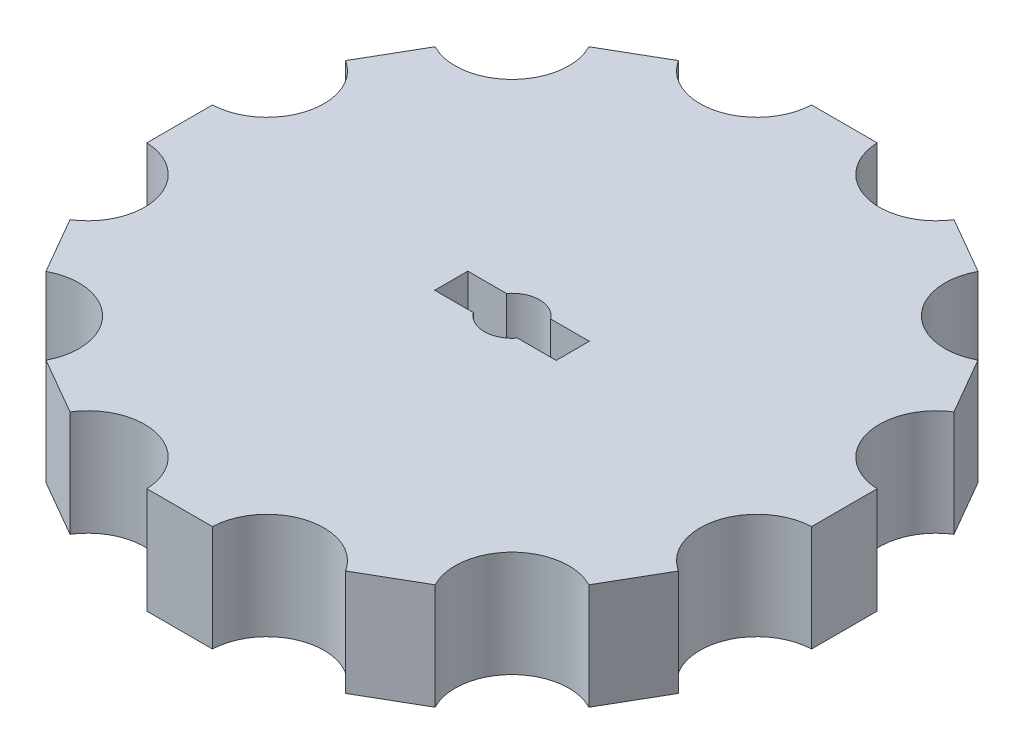
from build123d import *

# Parameters (mm, degrees)
BOSS_EXTRUDE1_DEPTH = 9.6
CUT_EXTRUDE1_DEPTH  = 44.617034843


with BuildPart() as part:
    # Sketch1 → Boss-Extrude1 (new body)
    with BuildSketch(Plane(origin=(0, 0, 0), x_dir=(1, 0, 0), z_dir=(0, 1, 0))):
        with BuildLine():
            ThreePointArc((-12.471666355, -27.539329703), (-6.782081918, -25.311074298), (-2.96888496, -30.085592303))
            Line((-2.96888496, -30.085592303), (2.96888496, -30.085592303))
            ThreePointArc((2.96888496, -30.085592303), (6.782081918, -25.311074298), (12.471666355, -27.539329703))
            Line((12.471666355, -27.539329703), (17.613925948, -24.570444742))
            ThreePointArc((17.613925948, -24.570444742), (18.52899238, -18.52899238), (24.570444742, -17.613925948))
            Line((24.570444742, -17.613925948), (27.539329703, -12.471666355))
            ThreePointArc((27.539329703, -12.471666355), (25.311074298, -6.782081918), (30.085592303, -2.96888496))
            Line((30.085592303, -2.96888496), (30.085592303, 2.96888496))
            ThreePointArc((30.085592303, 2.96888496), (25.311074298, 6.782081918), (27.539329703, 12.471666355))
            Line((27.539329703, 12.471666355), (24.570444742, 17.613925948))
            ThreePointArc((24.570444742, 17.613925948), (18.52899238, 18.52899238), (17.613925948, 24.570444742))
            Line((17.613925948, 24.570444742), (12.471666355, 27.539329703))
            ThreePointArc((12.471666355, 27.539329703), (6.782081918, 25.311074298), (2.96888496, 30.085592303))
            Line((2.96888496, 30.085592303), (-2.96888496, 30.085592303))
            ThreePointArc((-2.96888496, 30.085592303), (-6.782081918, 25.311074298), (-12.471666355, 27.539329703))
            Line((-12.471666355, 27.539329703), (-17.613925948, 24.570444742))
            ThreePointArc((-17.613925948, 24.570444742), (-18.52899238, 18.52899238), (-24.570444742, 17.613925948))
            Line((-24.570444742, 17.613925948), (-27.539329703, 12.471666355))
            ThreePointArc((-27.539329703, 12.471666355), (-25.311074298, 6.782081918), (-30.085592303, 2.96888496))
            Line((-30.085592303, 2.96888496), (-30.085592303, -2.96888496))
            ThreePointArc((-30.085592303, -2.96888496), (-25.311074298, -6.782081918), (-27.539329703, -12.471666355))
            Line((-27.539329703, -12.471666355), (-24.570444742, -17.613925948))
            ThreePointArc((-24.570444742, -17.613925948), (-18.52899238, -18.52899238), (-17.613925948, -24.570444742))
            Line((-17.613925948, -24.570444742), (-12.471666355, -27.539329703))
        make_face()
    extrude(amount=BOSS_EXTRUDE1_DEPTH)

    # Sketch2 → Cut-Extrude1 (cut, through all)
    with BuildSketch(Plane(origin=(0, 9.6, 0), x_dir=(1, 0, 0), z_dir=(0, 1, 0))):
        with BuildLine():
            Line((-2, -1.5), (-5.5, -1.5))
            Line((-5.5, -1.5), (-5.5, 1.5))
            Line((-5.5, 1.5), (-2, 1.5))
            ThreePointArc((-2, 1.5), (0, 2.5), (2, 1.5))
            Line((2, 1.5), (5.5, 1.5))
            Line((5.5, 1.5), (5.5, -1.5))
            Line((5.5, -1.5), (2, -1.5))
            ThreePointArc((2, -1.5), (0, -2.5), (-2, -1.5))
        make_face()
    extrude(amount=-CUT_EXTRUDE1_DEPTH, mode=Mode.SUBTRACT)


solid = part.part
